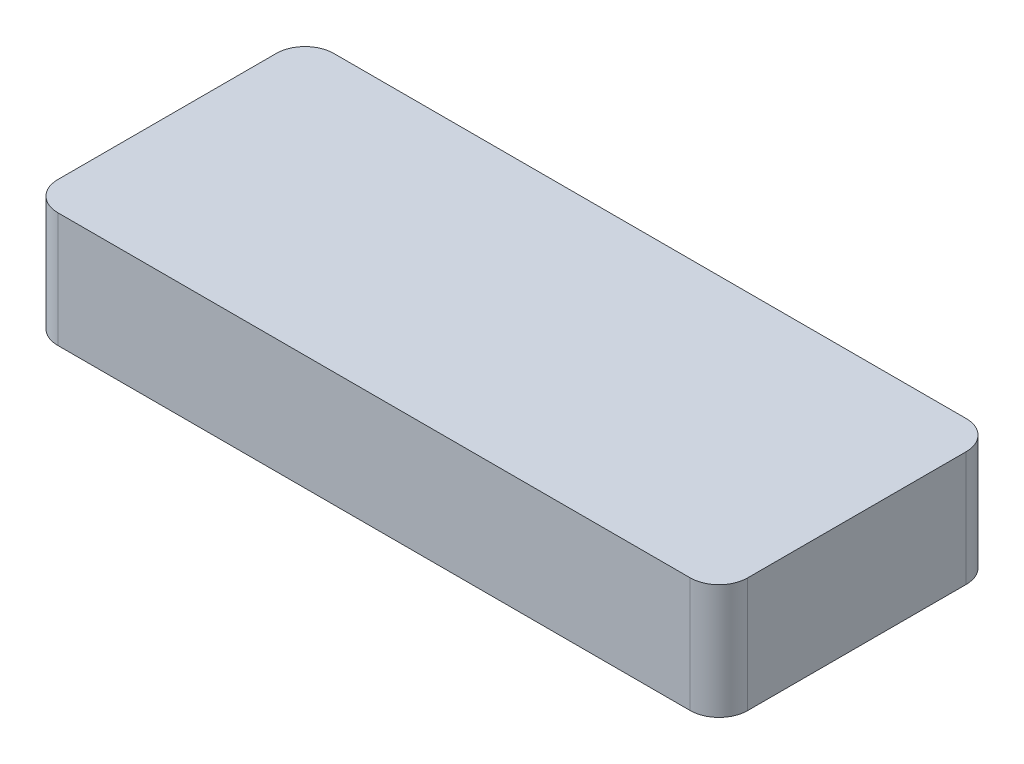
from build123d import *

# Parameters (mm, degrees)
SKETCH1_W           = 15.24
SKETCH1_H           = 6.096
BOSS_EXTRUDE1_DEPTH = 2.54
SHELL1_T            = -0.635
FILLET1_R           = 0.635
SKETCH2_R           = 1.5875
BOSS_EXTRUDE2_DEPTH = 1.905


with BuildPart() as part:
    # Sketch1 → Boss-Extrude1 (new body)
    with BuildSketch(Plane(origin=(0, 0, 0), x_dir=(1, 0, 0), z_dir=(0, 1, 0))):
        with Locations((7.62, 3.048)):
            Rectangle(SKETCH1_W, SKETCH1_H)
    extrude(amount=BOSS_EXTRUDE1_DEPTH)

    # Shell1
    shell1_openings = [part.faces().sort_by_distance(p)[0] for p in [
        (7.62, 0, -3.048),
    ]]
    offset(amount=SHELL1_T, openings=shell1_openings, kind=Kind.INTERSECTION)

    # Fillet1
    fillet1_edges = [part.edges().sort_by_distance(p)[0] for p in [
        (0, 1.27, 0),
        (15.24, 1.27, 0),
        (15.24, 1.27, -6.096),
        (0, 1.27, -6.096),
    ]]
    fillet(fillet1_edges, radius=FILLET1_R)

    # Sketch2 → Boss-Extrude2 (add)
    with BuildSketch(Plane.XZ.offset(-1.905)):
        with Locations(Location((7.62, -3.048, 0), (0, 0, 270))):
            Circle(SKETCH2_R)
    extrude(amount=BOSS_EXTRUDE2_DEPTH)


solid = part.part
